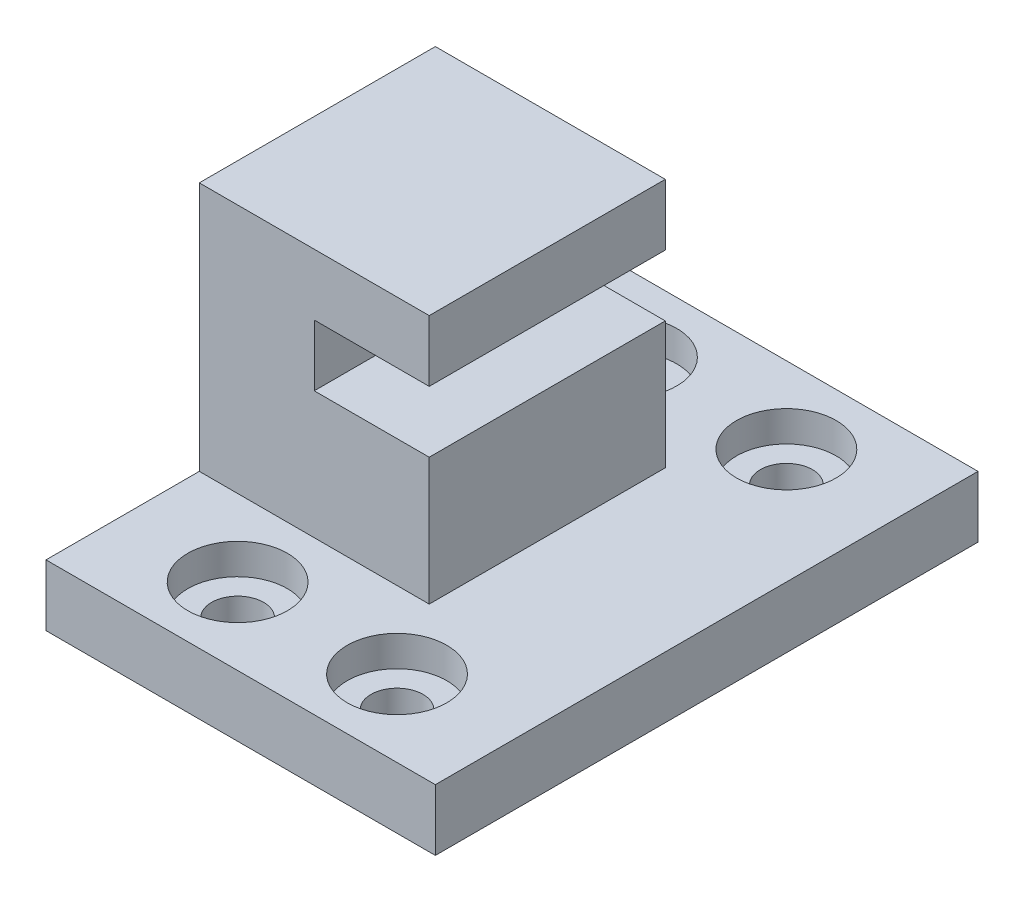
from build123d import *

# Parameters (mm, degrees)
CROQUIS1_W                                           = 10.4
CROQUIS1_H                                           = 20.4
SALIENTE_EXTRUIR1_DEPTH                              = 4
CROQUIS2_W                                           = 25.4
CROQUIS2_H                                           = 35.4
SALIENTE_EXTRUIR2_DEPTH                              = 4
CROQUIS3_W                                           = 15
CROQUIS3_H                                           = 15.4
SALIENTE_EXTRUIR3_DEPTH                              = 16.3
CROQUIS4_W                                           = 7.5
CROQUIS4_H                                           = 4
CORTAR_EXTRUIR1_DEPTH                                = 35.907592297
REFRENTADO_PARA_TORNILLO_CON_CABEZA_PLAN_D           = 3.4
REFRENTADO_PARA_TORNILLO_CON_CABEZA_PLAN_CBORE_D     = 6.5
REFRENTADO_PARA_TORNILLO_CON_CABEZA_PLAN_CBORE_DEPTH = 2


with BuildPart() as part:
    # Croquis1 → Saliente-Extruir1 (new body)
    with BuildSketch(Plane(origin=(0, 0, 0), x_dir=(1, 0, 0), z_dir=(0, 1, 0))):
        Rectangle(CROQUIS1_W, CROQUIS1_H)
    extrude(amount=SALIENTE_EXTRUIR1_DEPTH)

    # Croquis2 → Saliente-Extruir2 (add)
    with BuildSketch(Plane(origin=(0, 0, 0), x_dir=(1, 0, 0), z_dir=(0, 1, 0))):
        Rectangle(CROQUIS2_W, CROQUIS2_H)
    extrude(amount=SALIENTE_EXTRUIR2_DEPTH)

    # Croquis3 → Saliente-Extruir3 (add)
    with BuildSketch(Plane(origin=(0, 4, 0), x_dir=(1, 0, 0), z_dir=(0, 1, 0))):
        with Locations((-5.2, 0)):
            Rectangle(CROQUIS3_W, CROQUIS3_H)
    extrude(amount=SALIENTE_EXTRUIR3_DEPTH)

    # Croquis4 → Cortar-Extruir1 (cut, through all)
    with BuildSketch(Plane.XY.offset(7.7)):
        with Locations((-1.45, 14.3)):
            Rectangle(CROQUIS4_W, CROQUIS4_H)
    extrude(amount=-CORTAR_EXTRUIR1_DEPTH, mode=Mode.SUBTRACT)

    # Refrentado para tornillo con cabeza plana de M32 (through all)
    with Locations(Plane(origin=(0, 4, 0), x_dir=(1, 0, 0), z_dir=(0, 1, 0))):
        with Locations((-5.2, 12.7), (-5.2, -12.7), (5.2, -12.7), (5.2, 12.7)):
            CounterBoreHole(REFRENTADO_PARA_TORNILLO_CON_CABEZA_PLAN_D / 2, REFRENTADO_PARA_TORNILLO_CON_CABEZA_PLAN_CBORE_D / 2, REFRENTADO_PARA_TORNILLO_CON_CABEZA_PLAN_CBORE_DEPTH)


solid = part.part
